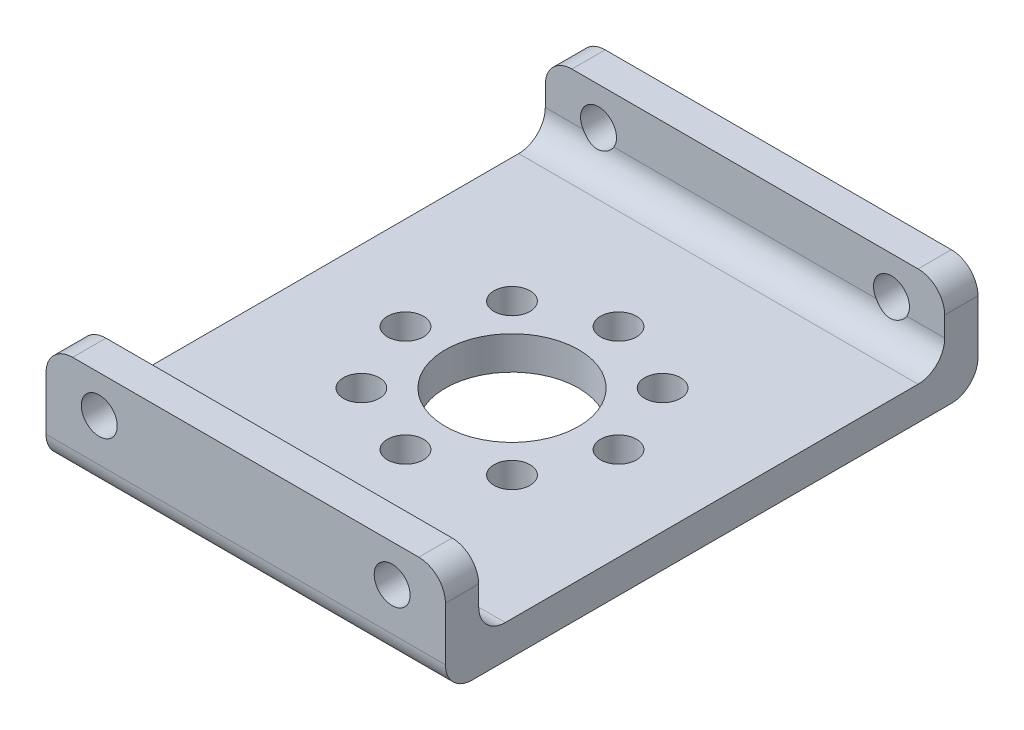
from build123d import *

# Parameters (mm, degrees)
ESBO_O1_W                = 30
ESBO_O1_H                = 30
RESSALTO_EXTRUS_O1_DEPTH = 40
ESBO_O2_W                = 35
ESBO_O2_H                = 27.5
CORTE_EXTRUS_O1_DEPTH    = 40
FILETE1_R                = 2
FILETE2_R                = 2
ESBO_O4_R                = 5
CORTE_EXTRUS_O3_DEPTH    = 53.201532545
ESBO_O5_R                = 1.35
CORTE_EXTRUS_O5_DEPTH    = 53.201532545
ESBO_O7_R                = 1.35
CORTE_EXTRUS_O6_DEPTH    = 46.276925691
ESBO_O8_W                = 30
ESBO_O8_H                = 22
CORTE_EXTRUS_O8_DEPTH    = 46.276925691
FILETE3_R                = 2
ESBO_O10_R               = 1.35
CORTE_EXTRUS_O9_DEPTH    = 46.276925691


with BuildPart() as part:
    # Esboço1 → Ressalto-extrusão1 (new body)
    with BuildSketch(Plane.XY):
        Rectangle(ESBO_O1_W, ESBO_O1_H)
    extrude(amount=RESSALTO_EXTRUS_O1_DEPTH)

    # Esboço2 → Corte-extrusão1 (cut)
    with BuildSketch(Plane(origin=(15, 0, 0), x_dir=(0, 0, -1), z_dir=(1, 0, 0))):
        with Locations((-20, 1.25)):
            Rectangle(ESBO_O2_W, ESBO_O2_H)
    extrude(amount=-CORTE_EXTRUS_O1_DEPTH, mode=Mode.SUBTRACT)

    # Filete1
    filete1_edges = [part.edges().sort_by_distance(p)[0] for p in [
        (-15, 15, 1.25),
        (15, 15, 1.25),
        (-15, 15, 38.75),
        (15, 15, 38.75),
    ]]
    fillet(filete1_edges, radius=FILETE1_R)

    # Filete2
    filete2_edges = [part.edges().sort_by_distance(p)[0] for p in [
        (0, -15, 40),
        (0, -12.5, 2.5),
        (0, -12.5, 37.5),
        (0, -15, 0),
    ]]
    fillet(filete2_edges, radius=FILETE2_R)

    # Esboço4 → Corte-extrusão3 (cut, through all)
    with BuildSketch(Plane(origin=(0, -15, 0), x_dir=(-1, 0, 0), z_dir=(0, -1, 0))):
        with Locations(Location((0, -20, 0), (0, 0, 90))):
            Circle(ESBO_O4_R)
    extrude(amount=-CORTE_EXTRUS_O3_DEPTH, mode=Mode.SUBTRACT)

    # Esboço5 → Corte-extrusão5 (cut, through all)
    with BuildSketch(Plane(origin=(0, -15, 0), x_dir=(-1, 0, 0), z_dir=(0, -1, 0))):
        with Locations(Location((0, -28, 0), (0, 0, 90))):
            Circle(ESBO_O5_R)
        with Locations(Location((-5.656854249, -25.656854249, 0), (0, 0, 90))):
            Circle(ESBO_O5_R)
        with Locations(Location((-8, -20, 0), (0, 0, 90))):
            Circle(ESBO_O5_R)
        with Locations(Location((-5.656854251, -14.343145752, 0), (0, 0, 90))):
            Circle(ESBO_O5_R)
        with Locations(Location((0, -12, 0), (0, 0, 90))):
            Circle(ESBO_O5_R)
        with Locations(Location((5.656854251, -14.343145752, 0), (0, 0, 90))):
            Circle(ESBO_O5_R)
        with Locations(Location((8, -20, 0), (0, 0, 90))):
            Circle(ESBO_O5_R)
        with Locations(Location((5.656854249, -25.656854249, 0), (0, 0, 90))):
            Circle(ESBO_O5_R)
    extrude(amount=-CORTE_EXTRUS_O5_DEPTH, mode=Mode.SUBTRACT)

    # Esboço7 → Corte-extrusão6 (cut, through all)
    with BuildSketch(Plane(origin=(0, 0, 0), x_dir=(-1, 0, 0), z_dir=(0, 0, -1))):
        with Locations((-11, 12.2)):
            Circle(ESBO_O7_R)
        with Locations((11, 12.2)):
            Circle(ESBO_O7_R)
    extrude(amount=-CORTE_EXTRUS_O6_DEPTH, mode=Mode.SUBTRACT)

    # Esboço8 → Corte-extrusão8 (cut, through all)
    with BuildSketch(Plane(origin=(0, 0, 0), x_dir=(-1, 0, 0), z_dir=(0, 0, -1))):
        with Locations((0, 4)):
            Rectangle(ESBO_O8_W, ESBO_O8_H)
    extrude(amount=-CORTE_EXTRUS_O8_DEPTH, mode=Mode.SUBTRACT)

    # Filete3
    filete3_edges = [part.edges().sort_by_distance(p)[0] for p in [
        (-15, -7, 38.75),
        (-15, -7, 1.25),
        (15, -7, 38.75),
        (15, -7, 1.25),
    ]]
    fillet(filete3_edges, radius=FILETE3_R)

    # Esboço10 → Corte-extrusão9 (cut, through all)
    with BuildSketch(Plane(origin=(0, 0, 0), x_dir=(-1, 0, 0), z_dir=(0, 0, -1))):
        with Locations((-11, -9.8)):
            Circle(ESBO_O10_R)
        with Locations((11, -9.8)):
            Circle(ESBO_O10_R)
    extrude(amount=-CORTE_EXTRUS_O9_DEPTH, mode=Mode.SUBTRACT)


solid = part.part
